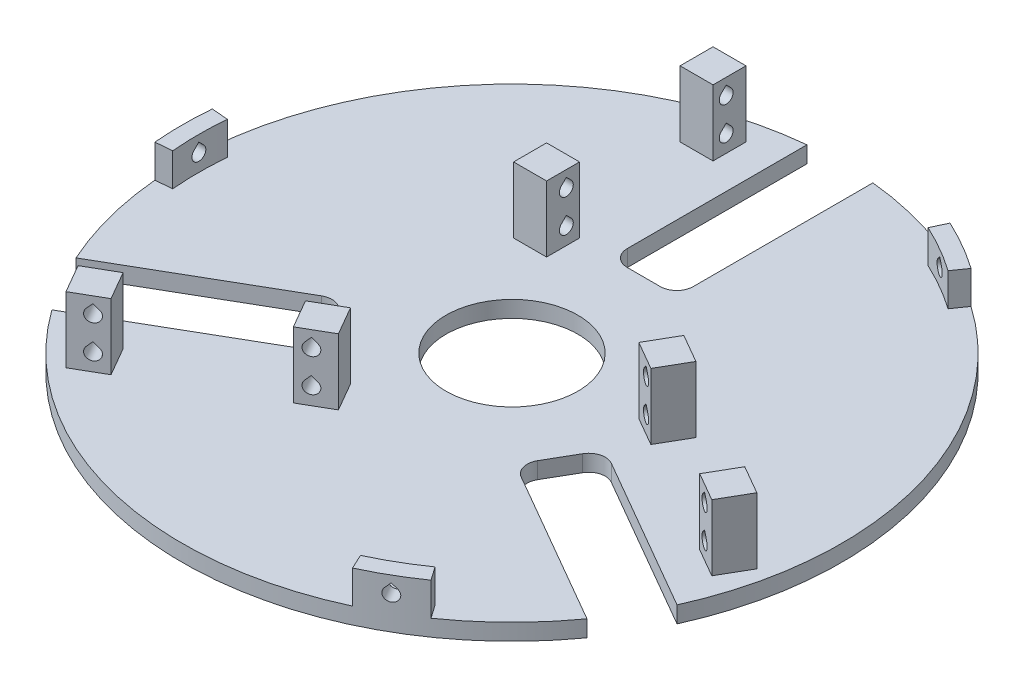
from build123d import *
from build123d.topology import SkipClean

# Parameters (mm, degrees)
SKETCH1_R                = 100
BOSS_EXTRUDE1_DEPTH      = 5
SKETCH2_W                = 10
SKETCH2_H                = 10
BOSS_EXTRUDE2_DEPTH      = 20
CUT_EXTRUDE1_REACH       = 160.193
CUT_EXTRUDE2_REACH       = 164.755
CUT_EXTRUDE3_REACH       = 164.755
CUT_EXTRUDE7_REACH       = 145.614
SKETCH8_R                = 20
BOSS_EXTRUDE4_DEPTH      = 10
CUT_EXTRUDE11_DEPTH      = 10
CUT_EXTRUDE11_DEPTH_BACK = 10
CUT_EXTRUDE12_DEPTH      = 10
CUT_EXTRUDE12_DEPTH_BACK = 10
CUT_EXTRUDE13_DEPTH      = 10
CUT_EXTRUDE13_DEPTH_BACK = 10


with BuildPart() as part:
    # Sketch1 → Boss-Extrude1 (new body)
    with BuildSketch(Plane(origin=(0, 0, 0), x_dir=(1, 0, 0), z_dir=(0, 1, 0))):
        Circle(SKETCH1_R)
    extrude(amount=BOSS_EXTRUDE1_DEPTH)

    # Sketch2 → Boss-Extrude2 (add)
    with BuildSketch(Plane(origin=(0, 5, 0), x_dir=(1, 0, 0), z_dir=(0, 1, 0))):
        with Locations((-25, 86)):
            Rectangle(SKETCH2_W, SKETCH2_H)
        with Locations((-25, 35.5)):
            Rectangle(SKETCH2_W, SKETCH2_H)
        Polygon((50.074028853, 5.730762114), (45.074028853, -2.929491924), (36.413774815, 2.070508076), (41.413774815, 10.730762114), align=None)
        Polygon((93.808311744, -19.519237886), (88.808311744, -28.179491924), (80.148057707, -23.179491924), (85.148057707, -14.519237886), align=None)
        Polygon((-20.074028853, -46.230762114), (-25.074028853, -37.570508076), (-16.413774815, -32.570508076), (-11.413774815, -41.230762114), align=None)
        Polygon((-63.808311744, -71.480762114), (-68.808311744, -62.820508076), (-60.148057707, -57.820508076), (-55.148057707, -66.480762114), align=None)
    extrude(amount=BOSS_EXTRUDE2_DEPTH)

    # Sketch3 → Cut-Extrude1 (cut, up to next)
    with BuildSketch(Plane(origin=(-20, 0, 0), x_dir=(0, 0, -1), z_dir=(1, 0, 0)), mode=Mode.PRIVATE) as cut_extrude1_sk1:
        with BuildLine():
            Line((83.51507576, 21.48492424), (85, 22.969848481))
            Line((85, 22.969848481), (86.48492424, 21.48492424))
            ThreePointArc((86.48492424, 21.48492424), (85, 17.9), (83.51507576, 21.48492424))
        make_face()
    cut_extrude1_tool1 = extrude(cut_extrude1_sk1.sketch, amount=-CUT_EXTRUDE1_REACH, mode=Mode.PRIVATE) & part.part
    # Sketch3 → Cut-Extrude1 (cut, up to next)
    with BuildSketch(Plane(origin=(-20, 0, 0), x_dir=(0, 0, -1), z_dir=(1, 0, 0)), mode=Mode.PRIVATE) as cut_extrude1_sk2:
        with BuildLine():
            Line((83.51507576, 11.48492424), (85, 12.969848481))
            Line((85, 12.969848481), (86.48492424, 11.48492424))
            ThreePointArc((86.48492424, 11.48492424), (85, 7.9), (83.51507576, 11.48492424))
        make_face()
    cut_extrude1_tool2 = extrude(cut_extrude1_sk2.sketch, amount=-CUT_EXTRUDE1_REACH, mode=Mode.PRIVATE) & part.part
    # Sketch3 → Cut-Extrude1 (cut, up to next)
    with BuildSketch(Plane(origin=(-20, 0, 0), x_dir=(0, 0, -1), z_dir=(1, 0, 0)), mode=Mode.PRIVATE) as cut_extrude1_sk3:
        with BuildLine():
            Line((36.5, 22.969848481), (35.01507576, 21.48492424))
            ThreePointArc((35.01507576, 21.48492424), (36.5, 17.9), (37.98492424, 21.48492424))
            Line((37.98492424, 21.48492424), (36.5, 22.969848481))
        make_face()
    cut_extrude1_tool3 = extrude(cut_extrude1_sk3.sketch, amount=-CUT_EXTRUDE1_REACH, mode=Mode.PRIVATE) & part.part
    # Sketch3 → Cut-Extrude1 (cut, up to next)
    with BuildSketch(Plane(origin=(-20, 0, 0), x_dir=(0, 0, -1), z_dir=(1, 0, 0)), mode=Mode.PRIVATE) as cut_extrude1_sk4:
        with BuildLine():
            Line((36.5, 12.969848481), (35.01507576, 11.48492424))
            ThreePointArc((35.01507576, 11.48492424), (36.5, 7.9), (37.98492424, 11.48492424))
            Line((37.98492424, 11.48492424), (36.5, 12.969848481))
        make_face()
    cut_extrude1_tool4 = extrude(cut_extrude1_sk4.sketch, amount=-CUT_EXTRUDE1_REACH, mode=Mode.PRIVATE) & part.part
    add(cut_extrude1_tool1.solids().sort_by_distance((-20, 20.147481, -85))[0], mode=Mode.SUBTRACT)
    add(cut_extrude1_tool2.solids().sort_by_distance((-20, 10.147481, -85))[0], mode=Mode.SUBTRACT)
    add(cut_extrude1_tool3.solids().sort_by_distance((-20, 20.147481, -36.5))[0], mode=Mode.SUBTRACT)
    add(cut_extrude1_tool4.solids().sort_by_distance((-20, 10.147481, -36.5))[0], mode=Mode.SUBTRACT)

    # Sketch4 → Cut-Extrude2 (cut, up to next)
    with BuildSketch(Plane(origin=(10, 0, 17.320508076), x_dir=(-0.8660254037844439, 0, 0.49999999999999095), z_dir=(-0.49999999999999095, 0, -0.8660254037844439)), mode=Mode.PRIVATE) as cut_extrude2_sk1:
        with BuildLine():
            Line((36.5, 22.969848481), (35.01507576, 21.48492424))
            ThreePointArc((35.01507576, 21.48492424), (36.5, 17.9), (37.98492424, 21.48492424))
            Line((37.98492424, 21.48492424), (36.5, 22.969848481))
        make_face()
    cut_extrude2_tool1 = extrude(cut_extrude2_sk1.sketch, amount=-CUT_EXTRUDE2_REACH, mode=Mode.PRIVATE) & part.part
    # Sketch4 → Cut-Extrude2 (cut, up to next)
    with BuildSketch(Plane(origin=(10, 0, 17.320508076), x_dir=(-0.8660254037844439, 0, 0.49999999999999095), z_dir=(-0.49999999999999095, 0, -0.8660254037844439)), mode=Mode.PRIVATE) as cut_extrude2_sk2:
        with BuildLine():
            Line((36.5, 12.969848481), (35.01507576, 11.48492424))
            ThreePointArc((35.01507576, 11.48492424), (36.5, 7.9), (37.98492424, 11.48492424))
            Line((37.98492424, 11.48492424), (36.5, 12.969848481))
        make_face()
    cut_extrude2_tool2 = extrude(cut_extrude2_sk2.sketch, amount=-CUT_EXTRUDE2_REACH, mode=Mode.PRIVATE) & part.part
    # Sketch4 → Cut-Extrude2 (cut, up to next)
    with BuildSketch(Plane(origin=(10, 0, 17.320508076), x_dir=(-0.8660254037844439, 0, 0.49999999999999095), z_dir=(-0.49999999999999095, 0, -0.8660254037844439)), mode=Mode.PRIVATE) as cut_extrude2_sk3:
        with BuildLine():
            Line((85, 22.969848481), (83.51507576, 21.48492424))
            ThreePointArc((83.51507576, 21.48492424), (85, 17.9), (86.48492424, 21.48492424))
            Line((86.48492424, 21.48492424), (85, 22.969848481))
        make_face()
    cut_extrude2_tool3 = extrude(cut_extrude2_sk3.sketch, amount=-CUT_EXTRUDE2_REACH, mode=Mode.PRIVATE) & part.part
    # Sketch4 → Cut-Extrude2 (cut, up to next)
    with BuildSketch(Plane(origin=(10, 0, 17.320508076), x_dir=(-0.8660254037844439, 0, 0.49999999999999095), z_dir=(-0.49999999999999095, 0, -0.8660254037844439)), mode=Mode.PRIVATE) as cut_extrude2_sk4:
        with BuildLine():
            Line((85, 12.969848481), (83.51507576, 11.48492424))
            ThreePointArc((83.51507576, 11.48492424), (85, 7.9), (86.48492424, 11.48492424))
            Line((86.48492424, 11.48492424), (85, 12.969848481))
        make_face()
    cut_extrude2_tool4 = extrude(cut_extrude2_sk4.sketch, amount=-CUT_EXTRUDE2_REACH, mode=Mode.PRIVATE) & part.part
    add(cut_extrude2_tool1.solids().sort_by_distance((-21.609927, 20.147481, 35.570508))[0], mode=Mode.SUBTRACT)
    add(cut_extrude2_tool2.solids().sort_by_distance((-21.609927, 10.147481, 35.570508))[0], mode=Mode.SUBTRACT)
    add(cut_extrude2_tool3.solids().sort_by_distance((-63.612159, 20.147481, 59.820508))[0], mode=Mode.SUBTRACT)
    add(cut_extrude2_tool4.solids().sort_by_distance((-63.612159, 10.147481, 59.820508))[0], mode=Mode.SUBTRACT)

    # Sketch5 → Cut-Extrude3 (cut, up to next)
    with BuildSketch(Plane(origin=(10, 0, -17.320508076), x_dir=(0.8660254037844367, 0, 0.5000000000000033), z_dir=(-0.5000000000000033, 0, 0.8660254037844367)), mode=Mode.PRIVATE) as cut_extrude3_sk1:
        with BuildLine():
            Line((36.5, 22.969848481), (35.01507576, 21.48492424))
            ThreePointArc((35.01507576, 21.48492424), (36.5, 17.9), (37.98492424, 21.48492424))
            Line((37.98492424, 21.48492424), (36.5, 22.969848481))
        make_face()
    cut_extrude3_tool1 = extrude(cut_extrude3_sk1.sketch, amount=-CUT_EXTRUDE3_REACH, mode=Mode.PRIVATE) & part.part
    # Sketch5 → Cut-Extrude3 (cut, up to next)
    with BuildSketch(Plane(origin=(10, 0, -17.320508076), x_dir=(0.8660254037844367, 0, 0.5000000000000033), z_dir=(-0.5000000000000033, 0, 0.8660254037844367)), mode=Mode.PRIVATE) as cut_extrude3_sk2:
        with BuildLine():
            Line((36.5, 12.969848481), (35.01507576, 11.48492424))
            ThreePointArc((35.01507576, 11.48492424), (36.5, 7.9), (37.98492424, 11.48492424))
            Line((37.98492424, 11.48492424), (36.5, 12.969848481))
        make_face()
    cut_extrude3_tool2 = extrude(cut_extrude3_sk2.sketch, amount=-CUT_EXTRUDE3_REACH, mode=Mode.PRIVATE) & part.part
    # Sketch5 → Cut-Extrude3 (cut, up to next)
    with BuildSketch(Plane(origin=(10, 0, -17.320508076), x_dir=(0.8660254037844367, 0, 0.5000000000000033), z_dir=(-0.5000000000000033, 0, 0.8660254037844367)), mode=Mode.PRIVATE) as cut_extrude3_sk3:
        with BuildLine():
            Line((85, 22.969848481), (83.51507576, 21.48492424))
            ThreePointArc((83.51507576, 21.48492424), (85, 17.9), (86.48492424, 21.48492424))
            Line((86.48492424, 21.48492424), (85, 22.969848481))
        make_face()
    cut_extrude3_tool3 = extrude(cut_extrude3_sk3.sketch, amount=-CUT_EXTRUDE3_REACH, mode=Mode.PRIVATE) & part.part
    # Sketch5 → Cut-Extrude3 (cut, up to next)
    with BuildSketch(Plane(origin=(10, 0, -17.320508076), x_dir=(0.8660254037844367, 0, 0.5000000000000033), z_dir=(-0.5000000000000033, 0, 0.8660254037844367)), mode=Mode.PRIVATE) as cut_extrude3_sk4:
        with BuildLine():
            Line((85, 12.969848481), (83.51507576, 11.48492424))
            ThreePointArc((83.51507576, 11.48492424), (85, 7.9), (86.48492424, 11.48492424))
            Line((86.48492424, 11.48492424), (85, 12.969848481))
        make_face()
    cut_extrude3_tool4 = extrude(cut_extrude3_sk4.sketch, amount=-CUT_EXTRUDE3_REACH, mode=Mode.PRIVATE) & part.part
    add(cut_extrude3_tool1.solids().sort_by_distance((41.609927, 20.147481, 0.929492))[0], mode=Mode.SUBTRACT)
    add(cut_extrude3_tool2.solids().sort_by_distance((41.609927, 10.147481, 0.929492))[0], mode=Mode.SUBTRACT)
    add(cut_extrude3_tool3.solids().sort_by_distance((83.612159, 20.147481, 25.179492))[0], mode=Mode.SUBTRACT)
    add(cut_extrude3_tool4.solids().sort_by_distance((83.612159, 10.147481, 25.179492))[0], mode=Mode.SUBTRACT)

    # Sketch8 → Cut-Extrude7 (cut, up to next)
    with BuildSketch(Plane(origin=(0, 0, 0), x_dir=(1, 0, 0), z_dir=(0, 1, 0)), mode=Mode.PRIVATE) as cut_extrude7_sk1:
        Circle(SKETCH8_R)
    cut_extrude7_tool1 = extrude(cut_extrude7_sk1.sketch, amount=CUT_EXTRUDE7_REACH, mode=Mode.PRIVATE) & part.part
    # Sketch8 → Cut-Extrude7 (cut, up to next)
    with BuildSketch(Plane(origin=(0, 0, 0), x_dir=(1, 0, 0), z_dir=(0, 1, 0)), mode=Mode.PRIVATE) as cut_extrude7_sk2:
        with BuildLine():
            Line((37.141016151, -15.669872981), (32.141016151, -24.330127019))
            ThreePointArc((32.141016151, -24.330127019), (31.641514039, -28.124222244), (33.97114317, -31.160254038))
            Line((33.97114317, -31.160254038), (85.932667397, -61.160254038))
            Line((85.932667397, -61.160254038), (95.932667397, -43.839745962))
            Line((95.932667397, -43.839745962), (43.97114317, -13.839745962))
            ThreePointArc((43.97114317, -13.839745962), (40.177047945, -13.34024385), (37.141016151, -15.669872981))
        make_face()
    cut_extrude7_tool2 = extrude(cut_extrude7_sk2.sketch, amount=CUT_EXTRUDE7_REACH, mode=Mode.PRIVATE) & part.part
    # Sketch8 → Cut-Extrude7 (cut, up to next)
    with BuildSketch(Plane(origin=(0, 0, 0), x_dir=(1, 0, 0), z_dir=(0, 1, 0)), mode=Mode.PRIVATE) as cut_extrude7_sk3:
        with BuildLine():
            Line((-5, 40), (5, 40))
            ThreePointArc((5, 40), (8.535533906, 41.464466094), (10, 45))
            Line((10, 45), (10, 105))
            Line((10, 105), (-10, 105))
            Line((-10, 105), (-10, 45))
            ThreePointArc((-10, 45), (-8.535533906, 41.464466094), (-5, 40))
        make_face()
    cut_extrude7_tool3 = extrude(cut_extrude7_sk3.sketch, amount=CUT_EXTRUDE7_REACH, mode=Mode.PRIVATE) & part.part
    # Sketch8 → Cut-Extrude7 (cut, up to next)
    with BuildSketch(Plane(origin=(0, 0, 0), x_dir=(1, 0, 0), z_dir=(0, 1, 0)), mode=Mode.PRIVATE) as cut_extrude7_sk4:
        with BuildLine():
            Line((-32.141016151, -24.330127019), (-37.141016151, -15.669872981))
            ThreePointArc((-37.141016151, -15.669872981), (-40.177047945, -13.34024385), (-43.97114317, -13.839745962))
            Line((-43.97114317, -13.839745962), (-95.932667397, -43.839745962))
            Line((-95.932667397, -43.839745962), (-85.932667397, -61.160254038))
            Line((-85.932667397, -61.160254038), (-33.97114317, -31.160254038))
            ThreePointArc((-33.97114317, -31.160254038), (-31.641514039, -28.124222244), (-32.141016151, -24.330127019))
        make_face()
    cut_extrude7_tool4 = extrude(cut_extrude7_sk4.sketch, amount=CUT_EXTRUDE7_REACH, mode=Mode.PRIVATE) & part.part
    add(cut_extrude7_tool1.solids().sort_by_distance((0, 0, 0))[0], mode=Mode.SUBTRACT)
    add(cut_extrude7_tool2.solids().sort_by_distance((63.013039, 0, 36.380595))[0], mode=Mode.SUBTRACT)
    add(cut_extrude7_tool3.solids().sort_by_distance((0, 0, -72.76119))[0], mode=Mode.SUBTRACT)
    add(cut_extrude7_tool4.solids().sort_by_distance((-63.013039, 0, 36.380595))[0], mode=Mode.SUBTRACT)

    # Sketch14 → Boss-Extrude4 (add)
    with SkipClean():  # the faces are left unmerged after this step: merging them gives an invalid solid
        with BuildSketch(Plane(origin=(0, 5, 0), x_dir=(1, 0, 0), z_dir=(0, 1, 0))):
            with BuildLine():
                Line((-99.619469809, 8.715574275), (-94.638496319, 8.279795561))
                ThreePointArc((-94.638496319, 8.279795561), (-95, 0), (-94.638496319, -8.279795561))
                Line((-94.638496319, -8.279795561), (-99.619469809, -8.715574275))
                ThreePointArc((-99.619469809, -8.715574275), (-100, 0), (-99.619469809, 8.715574275))
            make_face()
            with BuildLine():
                Line((57.357643635, 81.915204429), (54.489761453, 77.819444207))
                ThreePointArc((54.489761453, 77.819444207), (47.5, 82.27241336), (40.148734865, 86.099239768))
                Line((40.148734865, 86.099239768), (42.261826174, 90.630778704))
                ThreePointArc((42.261826174, 90.630778704), (50, 86.602540378), (57.357643635, 81.915204429))
            make_face()
            with BuildLine():
                Line((42.261826174, -90.630778704), (40.148734865, -86.099239768))
                ThreePointArc((40.148734865, -86.099239768), (47.5, -82.27241336), (54.489761453, -77.819444207))
                Line((54.489761453, -77.819444207), (57.357643635, -81.915204429))
                ThreePointArc((57.357643635, -81.915204429), (50, -86.602540378), (42.261826174, -90.630778704))
            make_face()
        extrude(amount=BOSS_EXTRUDE4_DEPTH)

    # Sketch15 → Cut-Extrude11 (cut, two sides: drawn at the far end of the back side and taken through both)
    with SkipClean():  # the faces are left unmerged after this step: merging them gives an invalid solid
        with BuildSketch(Plane.ZY.offset(100).offset(-CUT_EXTRUDE11_DEPTH_BACK)):
            with BuildLine():
                Line((0, 12.969848481), (-1.48492424, 11.48492424))
                ThreePointArc((-1.48492424, 11.48492424), (0, 7.9), (1.48492424, 11.48492424))
                Line((1.48492424, 11.48492424), (0, 12.969848481))
            make_face()
        extrude(amount=CUT_EXTRUDE11_DEPTH + CUT_EXTRUDE11_DEPTH_BACK, mode=Mode.SUBTRACT)

    # Sketch16 → Cut-Extrude12 (cut, two sides: drawn at the far end of the back side and taken through both)
    with SkipClean():  # the faces are left unmerged after this step: merging them gives an invalid solid
        with BuildSketch(Plane(origin=(50, 0, 86.602540378), x_dir=(0.8660254037844386, 0, -0.5000000000000001), z_dir=(0.5000000000000001, 0, 0.8660254037844386)).offset(-CUT_EXTRUDE12_DEPTH_BACK)):
            with BuildLine():
                Line((-1.48492424, 11.48492424), (0, 12.969848481))
                Line((0, 12.969848481), (1.48492424, 11.48492424))
                ThreePointArc((1.48492424, 11.48492424), (0, 7.9), (-1.48492424, 11.48492424))
            make_face()
        extrude(amount=CUT_EXTRUDE12_DEPTH + CUT_EXTRUDE12_DEPTH_BACK, mode=Mode.SUBTRACT)

    # Sketch17 → Cut-Extrude13 (cut, two sides: drawn at the far end of the back side and taken through both)
    with SkipClean():  # the faces are left unmerged after this step: merging them gives an invalid solid
        with BuildSketch(Plane(origin=(50, 0, -86.602540378), x_dir=(-0.8660254037844388, 0, -0.49999999999999983), z_dir=(0.4999999999999998, 0, -0.8660254037844387)).offset(-CUT_EXTRUDE13_DEPTH_BACK)):
            with BuildLine():
                Line((-1.48492424, 11.48492424), (0, 12.969848481))
                Line((0, 12.969848481), (1.48492424, 11.48492424))
                ThreePointArc((1.48492424, 11.48492424), (0, 7.9), (-1.48492424, 11.48492424))
            make_face()
        extrude(amount=CUT_EXTRUDE13_DEPTH + CUT_EXTRUDE13_DEPTH_BACK, mode=Mode.SUBTRACT)


solid = part.part
